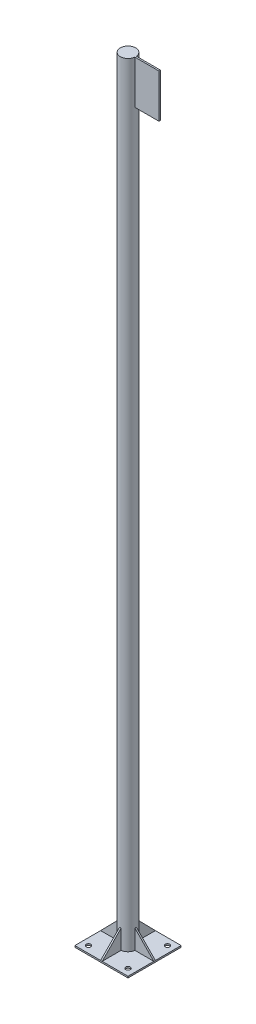
from build123d import *

# Parameters (mm, degrees)
CROQUIS1_W              = 220
CROQUIS1_H              = 220
SALIENTE_EXTRUIR1_DEPTH = 6.35
CROQUIS2_R              = 31.75
SALIENTE_EXTRUIR2_DEPTH = 3200
SALIENTE_EXTRUIR3_DEPTH = 80
CORTAR_EXTRUIR1_DEPTH   = 6.35
CORTAR_EXTRUIR2_DEPTH   = 6.35
CROQUIS6_R              = 9.525
CORTAR_EXTRUIR3_DEPTH   = 6.35
SALIENTE_EXTRUIR4_START = -180
SALIENTE_EXTRUIR4_DEPTH = 180


with BuildPart() as part:
    # Croquis1 → Saliente-Extruir1 (new body)
    with BuildSketch(Plane(origin=(0, 0, 0), x_dir=(1, 0, 0), z_dir=(0, 1, 0))):
        with Locations((110, 110)):
            Rectangle(CROQUIS1_W, CROQUIS1_H)
    extrude(amount=SALIENTE_EXTRUIR1_DEPTH)

    # Croquis2 → Saliente-Extruir2 (add)
    with BuildSketch(Plane(origin=(0, 6.35, 0), x_dir=(1, 0, 0), z_dir=(0, 1, 0))):
        with Locations(Location((110, 110, 0), (0, 0, 90))):
            Circle(CROQUIS2_R)
    extrude(amount=SALIENTE_EXTRUIR2_DEPTH)

    # Croquis3 → Saliente-Extruir3 (add)
    with BuildSketch(Plane(origin=(0, 6.35, 0), x_dir=(1, 0, 0), z_dir=(0, 1, 0))):
        with BuildLine():
            Line((0, 113.175), (78.409148872, 113.175))
            ThreePointArc((78.409148872, 113.175), (78.25, 110), (78.409148872, 106.825))
            Line((78.409148872, 106.825), (0, 106.825))
            Line((0, 106.825), (0, 113.175))
        make_face()
        with BuildLine():
            Line((106.825, 220), (106.825, 141.590851128))
            ThreePointArc((106.825, 141.590851128), (110, 141.75), (113.175, 141.590851128))
            Line((113.175, 141.590851128), (113.175, 220))
            Line((113.175, 220), (106.825, 220))
        make_face()
        with BuildLine():
            Line((106.825, 0), (113.175, 0))
            Line((113.175, 0), (113.175, 78.409148872))
            ThreePointArc((113.175, 78.409148872), (110, 78.25), (106.825, 78.409148872))
            Line((106.825, 78.409148872), (106.825, 0))
        make_face()
        with BuildLine():
            Line((220, 106.825), (220, 113.175))
            Line((220, 113.175), (141.590851128, 113.175))
            ThreePointArc((141.590851128, 113.175), (141.75, 110), (141.590851128, 106.825))
            Line((141.590851128, 106.825), (220, 106.825))
        make_face()
    extrude(amount=SALIENTE_EXTRUIR3_DEPTH)

    # Croquis4 → Cortar-Extruir1 (cut)
    with BuildSketch(Plane.XY.offset(-106.825)):
        Polygon((78.409148872, 86.35), (0, 6.35), (0, 86.35), align=None)
        Polygon((141.590851128, 86.35), (220, 86.35), (220, 6.35), align=None)
    extrude(amount=-CORTAR_EXTRUIR1_DEPTH, mode=Mode.SUBTRACT)

    # Croquis5 → Cortar-Extruir2 (cut)
    with BuildSketch(Plane.ZY.offset(-106.825)):
        Polygon((-220, 6.35), (-141.590851128, 86.35), (-220, 86.35), align=None)
        Polygon((-78.409148872, 86.35), (0, 6.35), (0, 86.35), align=None)
    extrude(amount=-CORTAR_EXTRUIR2_DEPTH, mode=Mode.SUBTRACT)

    # Croquis6 → Cortar-Extruir3 (cut)
    with BuildSketch(Plane(origin=(0, 6.35, 0), x_dir=(1, 0, 0), z_dir=(0, 1, 0))):
        with Locations(Location((191.715728753, 191.715728753, 0), (0, 0, 270))):
            Circle(CROQUIS6_R)
        with Locations(Location((191.715728753, 28.284271247, 0), (0, 0, 90))):
            Circle(CROQUIS6_R)
        with Locations(Location((28.284271247, 28.284271247, 0), (0, 0, 270))):
            Circle(CROQUIS6_R)
        with Locations(Location((28.284271247, 191.715728753, 0), (0, 0, 90))):
            Circle(CROQUIS6_R)
    extrude(amount=-CORTAR_EXTRUIR3_DEPTH, mode=Mode.SUBTRACT)

    # Croquis7 → Saliente-Extruir4 (add)
    with BuildSketch(Plane(origin=(0, 3206.35, 0), x_dir=(1, 0, 0), z_dir=(0, 1, 0)).offset(SALIENTE_EXTRUIR4_START)):
        with BuildLine():
            Line((241.590851128, 113.175), (141.590851128, 113.175))
            ThreePointArc((141.590851128, 113.175), (141.75, 110), (141.590851128, 106.825))
            Line((141.590851128, 106.825), (241.590851128, 106.825))
            Line((241.590851128, 106.825), (241.590851128, 113.175))
        make_face()
    extrude(amount=SALIENTE_EXTRUIR4_DEPTH)


solid = part.part
